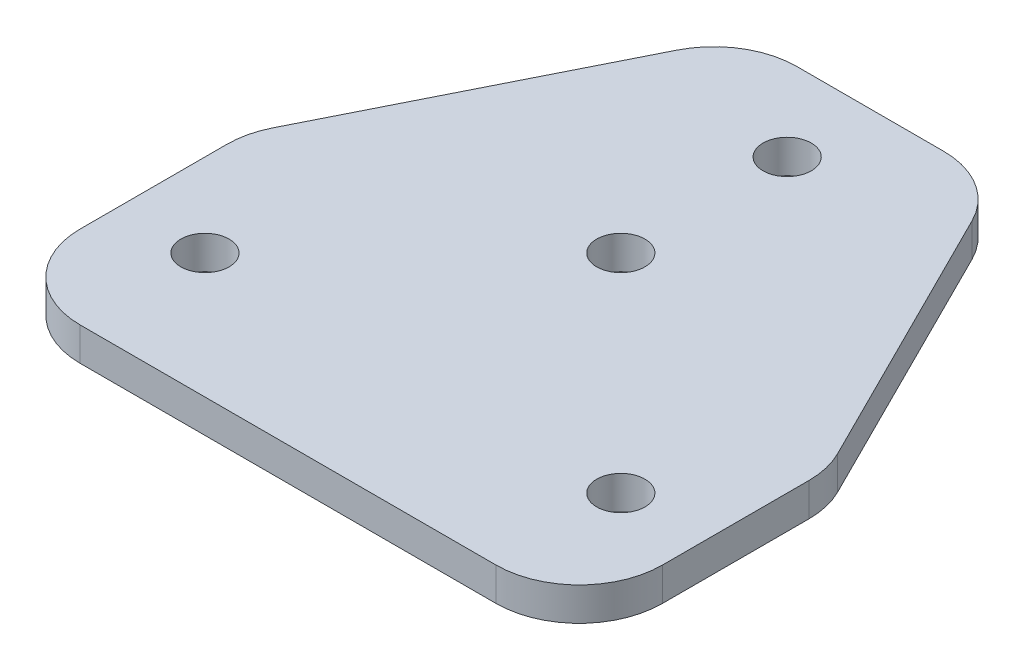
from build123d import *

# Parameters (mm, degrees)
SKETCH_1_R      = 1.45
EXTRUDE_1_DEPTH = 2
FILLET_1_R      = 5


with BuildPart() as part:
    # 草图1 → 凸台-拉伸1 (new body)
    with BuildSketch(Plane(origin=(0, 0, 0), x_dir=(1, 0, 0), z_dir=(0, 1, 0))):
        Polygon((-17.5, -7.5), (-17.5, 7.5), (-7.5, 27.5), (7.5, 27.5), (17.5, 7.5), (17.5, -7.5), align=None)
        with Locations(Location((12.5, 0, 0), (0, 0, 270))):
            Circle(SKETCH_1_R, mode=Mode.SUBTRACT)
        with Locations(Location((0, 12.5, 0), (0, 0, 270))):
            Circle(SKETCH_1_R, mode=Mode.SUBTRACT)
        with Locations(Location((0, 22.5, 0), (0, 0, 270))):
            Circle(SKETCH_1_R, mode=Mode.SUBTRACT)
        with Locations(Location((-12.5, 0, 0), (0, 0, 90))):
            Circle(SKETCH_1_R, mode=Mode.SUBTRACT)
    extrude(amount=EXTRUDE_1_DEPTH)

    # 圆角1
    fillet_1_edges = [part.edges().sort_by_distance(p)[0] for p in [
        (17.5, 1, 7.5),
        (-17.5, 1, 7.5),
        (-17.5, 1, -7.5),
        (-7.5, 1, -27.5),
        (7.5, 1, -27.5),
        (17.5, 1, -7.5),
    ]]
    fillet(fillet_1_edges, radius=FILLET_1_R)


solid = part.part
